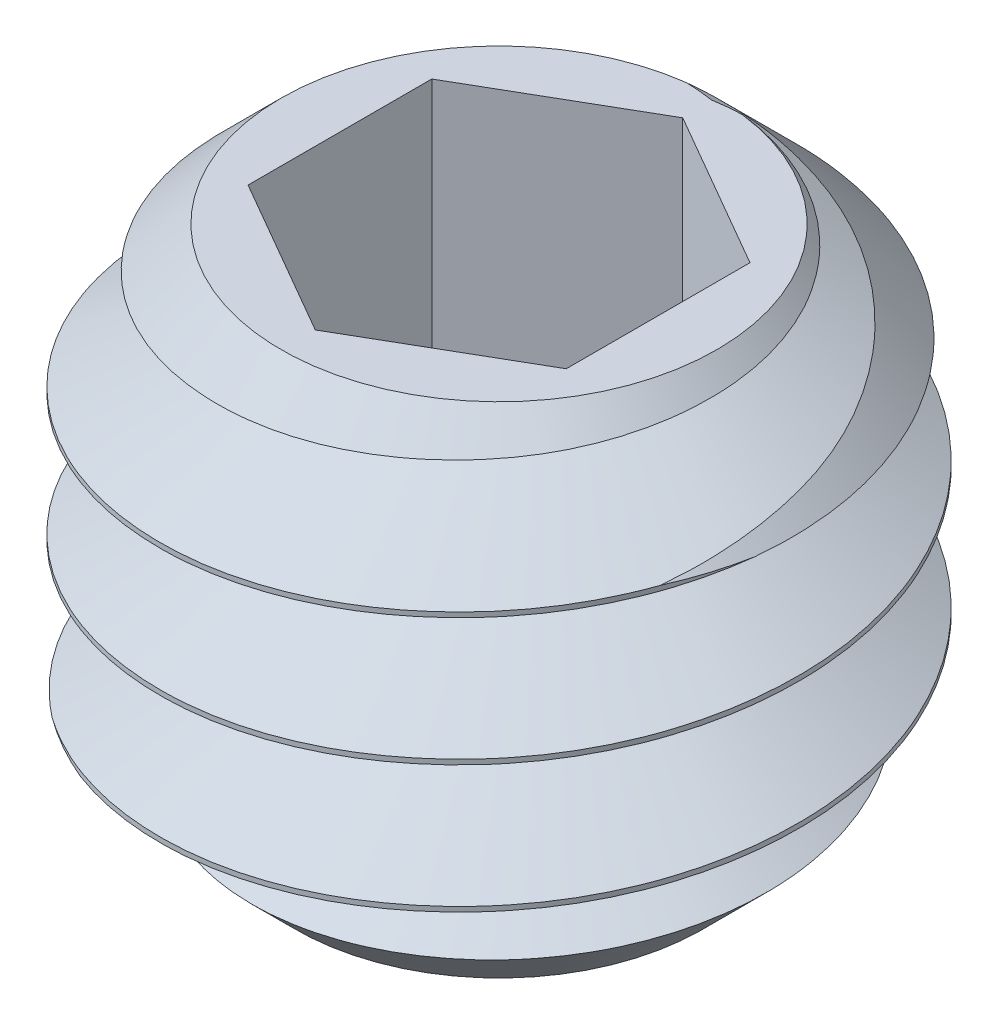
from build123d import *

# Parameters (mm, degrees)
CUT_EXTRUDE1_DEPTH     = 1.778
CUT_SWEEP3_PITCH       = 0.7950199999999968
CUT_SWEEP3_HEIGHT      = 9.525000000000002
CUT_SWEEP3_RADIUS      = 1.9938999999999998
CUT_SWEEP3_START_ANGLE = -180


with BuildPart() as part:
    # Sketch1 → Revolve1 (revolve)
    with BuildSketch(Plane.XY, mode=Mode.PRIVATE) as revolve1_sk:
        Polygon((0, 0.5865878734966664), (-1.016, 2e-17), (-1.2699999999999998, -2e-17), (-1.9938999999999998, 0.7239000000000022), (-1.9938999999999998, 2.5400000000000014), (-1.3588999999999998, 3.175), (7e-17, 3.175), align=None)
    revolve(revolve1_sk.sketch.rotate(Axis((0, 0, 0), (0, 1, 0)), 270), axis=Axis((0, 0, 0), (0, 1, 0)))

    # Sketch2 → Cut-Extrude1 (cut)
    with BuildSketch(Plane(origin=(0, 3.175, 0), x_dir=(1, 0, 0), z_dir=(0, 1, 0))):
        Polygon((-2.2e-16, 1.145679440423164), (-0.9921875000000002, 0.5728397202115824), (-0.9921875000000002, -0.5728397202115817), (-2.4e-16, -1.1456794404231636), (0.9921875, -0.5728397202115821), (0.9921874999999996, 0.5728397202115822), align=None)
    extrude(amount=-CUT_EXTRUDE1_DEPTH, mode=Mode.SUBTRACT)

    # Cut-Sweep3: sweep along a helix
    with BuildLine() as cut_sweep3_path:
        add(Helix(CUT_SWEEP3_PITCH, CUT_SWEEP3_HEIGHT, CUT_SWEEP3_RADIUS, center=(0, 3.175, 0), direction=(0, -1, 0), mode=Mode.PRIVATE).rotate(Axis((0, 3.175, 0), (0, -1, 0)), CUT_SWEEP3_START_ANGLE))
    with BuildLine() as cut_sweep3_axis:
        Line((0, 3.175, 0), (0, -6.350000000000002, 0))
    # Sketch4 → Cut-Sweep3 (sweep, cut)
    with BuildSketch(Plane(origin=(0, 0, 0), x_dir=(0, 0, -1), z_dir=(1, 0, 0))):
        Polygon((-2.0192999999999994, 3.968749999999999), (-2.0192999999999994, 3.175), (-1.3318923357460979, 3.5718749999999995), align=None)
    sweep(path=cut_sweep3_path.line, binormal=cut_sweep3_axis.edges()[0], mode=Mode.SUBTRACT)


solid = part.part
